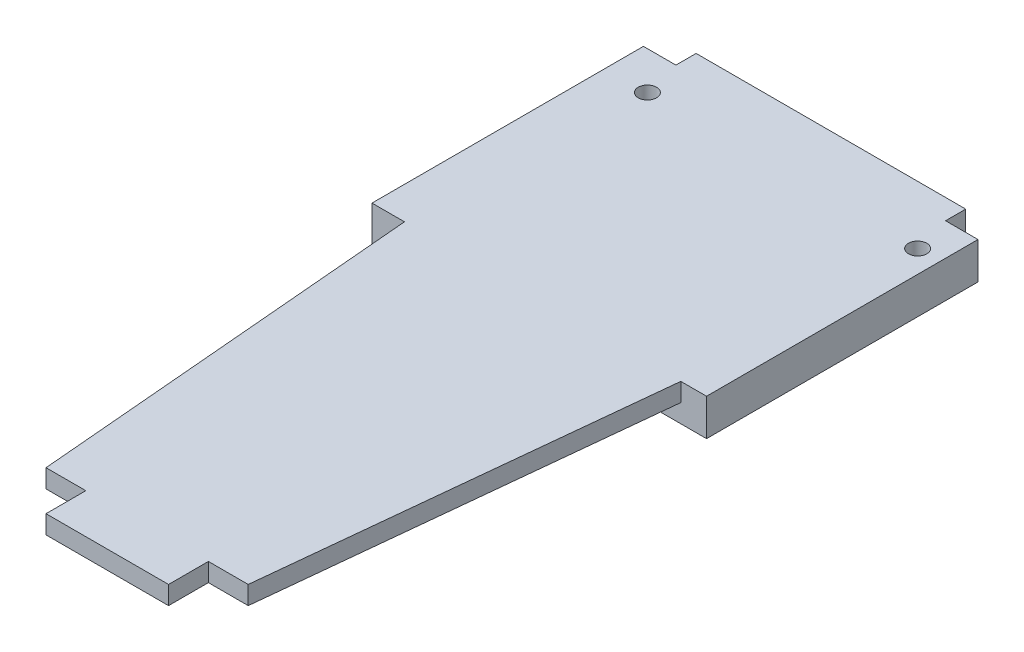
from build123d import *

# Parameters (mm, degrees)
BOSS_EXTRUDE1_DEPTH = 3
SKETCH2_R           = 1.5
CUT_EXTRUDE1_DEPTH  = 3
BOSS_EXTRUDE2_START = 3
SKETCH3_R           = 1.5
BOSS_EXTRUDE2_DEPTH = 3


with BuildPart() as part:
    # Sketch1 → Boss-Extrude1 (new body)
    with BuildSketch(Plane(origin=(0, 0, 0), x_dir=(1, 0, 0), z_dir=(0, 1, 0))):
        Polygon((-22, 64), (-16.5, 0), (-10, 0), (-10, -6.5), (10, -6.5), (10, 0), (16.5, 0), (23.1, 64), (27.3, 64), (27.3, 108.3), (22, 108.3), (22, 111.6), (-22, 111.6), (-22, 108.3), (-27.3, 108.3), (-27.3, 64), align=None)
    extrude(amount=BOSS_EXTRUDE1_DEPTH)

    # Sketch2 → Cut-Extrude1 (cut)
    with BuildSketch(Plane.XZ):
        with Locations(Location((23.65, -102.1, 0), (0, 0, 270))):
            Circle(SKETCH2_R)
        with Locations(Location((-20.45, -102.1, 0), (0, 0, 270))):
            Circle(SKETCH2_R)
    extrude(amount=-CUT_EXTRUDE1_DEPTH, mode=Mode.SUBTRACT)

    # Sketch3 → Boss-Extrude2 (add)
    with BuildSketch(Plane.XZ.offset(BOSS_EXTRUDE2_START)):
        Polygon((-22, -64), (23.1, -64), (27.3, -64), (27.3, -108.3), (22, -108.3), (22, -111.6), (-22, -111.6), (-22, -108.3), (-27.3, -108.3), (-27.3, -64), align=None)
        with Locations(Location((-20.45, -102.1, 0), (0, 0, 270))):
            Circle(SKETCH3_R, mode=Mode.SUBTRACT)
        with Locations(Location((23.65, -102.1, 0), (0, 0, 270))):
            Circle(SKETCH3_R, mode=Mode.SUBTRACT)
    extrude(amount=-BOSS_EXTRUDE2_DEPTH)


solid = part.part
